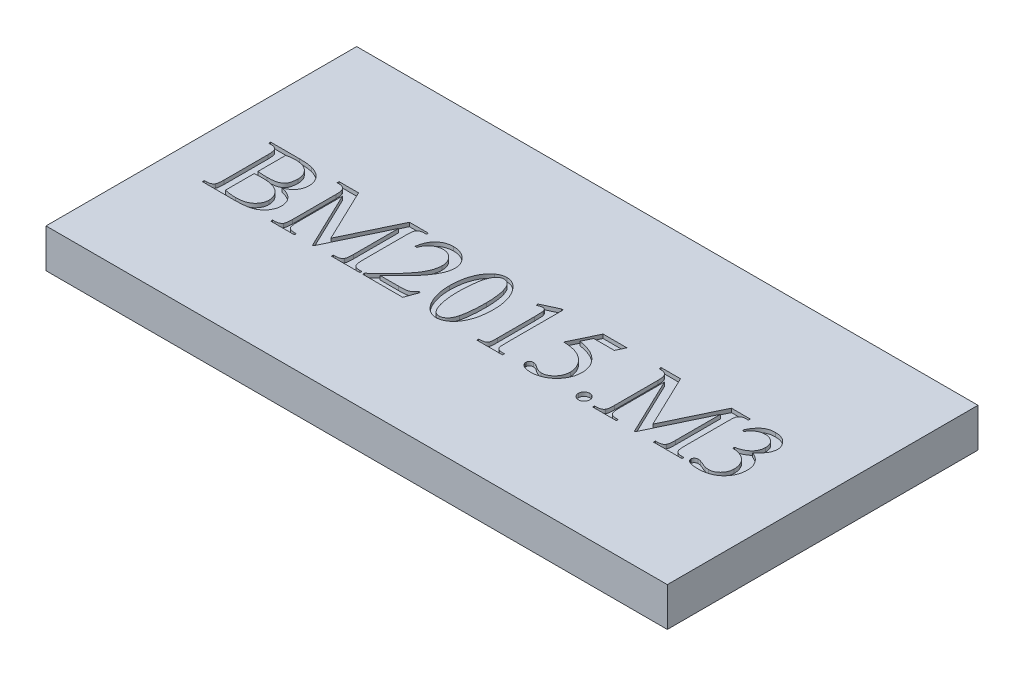
from build123d import *

# Parameters (mm, degrees)
SKETCH_1_W          = 160
SKETCH_1_H          = 80
EXTRUDE_1_DEPTH     = 10
CUT_EXTRUDE_1_DEPTH = 1


with BuildPart() as part:
    # Эскиз1 → Бобышка-Вытянуть1 (new body)
    with BuildSketch(Plane(origin=(0, 0, 0), x_dir=(1, 0, 0), z_dir=(0, 1, 0))):
        Rectangle(SKETCH_1_W, SKETCH_1_H)
    extrude(amount=EXTRUDE_1_DEPTH)

    # Эскиз2 → Вырез-Вытянуть1 (cut)
    # profile 1 of 9: a face of its own
    with BuildSketch(Plane(origin=(0, 10, 0), x_dir=(1, 0, 0), z_dir=(0, 1, 0))):
        with BuildLine():
            add(Edge.make_bspline(
                [(-58.083307054, -1.12936359), (-57.935151583, -1.162218616), (-57.647224583, -1.226069441), (-57.233701046, -1.344617735), (-56.85051146, -1.47956541), (-56.493404032, -1.623649358), (-56.164474978, -1.783325876), (-55.864999545, -1.959081857), (-55.595654967, -2.150476291), (-55.433679051, -2.291199058), (-55.354468452, -2.360016293)],
                knots=[0, 0, 0, 0, 1.202298385, 2.336560135, 3.406084711, 4.420247637, 5.386399354, 6.300522109, 7.168909389, 8, 8, 8, 8], degree=3))
            add(Edge.make_bspline(
                [(-55.354468452, -2.360016293), (-55.254240258, -2.45868109), (-55.056391441, -2.653443788), (-54.800647537, -2.975704736), (-54.585222065, -3.31438968), (-54.407168596, -3.668692158), (-54.270098938, -4.040713305), (-54.169543605, -4.428340837), (-54.111729232, -4.832307411), (-54.104533282, -5.106509479), (-54.100884332, -5.245552911)],
                knots=[0, 0, 0, 0, 1.040892545, 2.054704896, 3.038886078, 4.009403739, 4.985637774, 5.96968326, 6.970459233, 8, 8, 8, 8], degree=3))
            add(Edge.make_bspline(
                [(-54.100884332, -5.245552911), (-54.109773906, -5.459326742), (-54.127634896, -5.888842475), (-54.295807273, -6.522135238), (-54.552689425, -7.143512483), (-54.912842113, -7.737821359), (-55.35300588, -8.29336594), (-55.890156435, -8.76594946), (-56.496512251, -9.163913784), (-57.062965395, -9.427120756), (-57.567328024, -9.591580546), (-57.996528063, -9.700807422), (-58.471665181, -9.79862292), (-58.995936524, -9.865487586), (-59.565085802, -9.929753148), (-60.182391491, -9.968570826), (-60.846269083, -9.997197456), (-61.305134604, -9.999045516), (-61.542129093, -10)],
                knots=[0, 0, 0, 0, 1.028770293, 2.067011775, 3.138033473, 4.261901228, 5.406207792, 6.541562624, 7.694800496, 8.892876887, 9.539626609, 10.250184141, 11.027081459, 11.876550478, 12.796927842, 13.788050093, 14.85757392, 16, 16, 16, 16], degree=3))
            Line((-61.542129093, -10), (-69.75539822, -10))
            Line((-69.75539822, -10), (-69.75539822, -9.510796441))
            Line((-69.75539822, -9.510796441), (-69.117140452, -9.510796441))
            add(Edge.make_bspline(
                [(-69.117140452, -9.510796441), (-69.031623978, -9.508896469), (-68.866223486, -9.505221663), (-68.628601462, -9.468555371), (-68.407591735, -9.418383705), (-68.208553017, -9.33583787), (-68.025639816, -9.235762485), (-67.860349201, -9.114310171), (-67.716452197, -8.965560139), (-67.636649307, -8.85326698), (-67.596023136, -8.796100616)],
                knots=[0, 0, 0, 0, 1.166786496, 2.256723755, 3.277842578, 4.25348796, 5.187934752, 6.120436128, 7.043148905, 8, 8, 8, 8], degree=3))
            add(Edge.make_bspline(
                [(-67.596023136, -8.796100616), (-67.571713165, -8.752126879), (-67.519273623, -8.65727022), (-67.465120099, -8.488517952), (-67.415028953, -8.29096451), (-67.378860094, -8.059207847), (-67.348406901, -7.795301677), (-67.326671955, -7.498195236), (-67.310194933, -7.169426686), (-67.309659765, -6.939953985), (-67.309380425, -6.820176866)],
                knots=[0, 0, 0, 0, 0.597321695, 1.288494999, 2.101981578, 3.025155317, 4.079375286, 5.266669335, 6.573292293, 8, 8, 8, 8], degree=3))
            Line((-67.309380425, -6.820176866), (-67.309380425, 4.431504991))
            add(Edge.make_bspline(
                [(-67.309380425, 4.431504991), (-67.309187714, 4.564044157), (-67.308820582, 4.816542143), (-67.331060069, 5.175734867), (-67.353432169, 5.49775157), (-67.397357301, 5.780488463), (-67.445093055, 6.026200292), (-67.503113973, 6.234101896), (-67.579857841, 6.40226176), (-67.643258386, 6.494765474), (-67.672461192, 6.537373437)],
                knots=[0, 0, 0, 0, 1.467983741, 2.79662948, 3.986363477, 5.042318655, 5.964098798, 6.759038926, 7.428403245, 8, 8, 8, 8], degree=3))
            add(Edge.make_bspline(
                [(-67.672461192, 6.537373437), (-67.75871544, 6.62793383), (-67.93276243, 6.810669917), (-68.27906898, 6.993817977), (-68.679994602, 7.101831697), (-68.966045307, 7.115110536), (-69.117140452, 7.122124566)],
                knots=[0, 0, 0, 0, 0.927123666, 1.870784184, 2.875324672, 4, 4, 4, 4], degree=3))
            Line((-69.117140452, 7.122124566), (-69.75539822, 7.122124566))
            Line((-69.75539822, 7.122124566), (-69.75539822, 7.611328125))
            Line((-69.75539822, 7.611328125), (-62.321797265, 7.611328125))
            add(Edge.make_bspline(
                [(-62.321797265, 7.611328125), (-61.991696852, 7.608620798), (-61.366532154, 7.603493494), (-60.480230914, 7.540198231), (-59.694905134, 7.449140638), (-59.211425828, 7.343516417), (-58.985276116, 7.294110192)],
                knots=[0, 0, 0, 0, 1.179035714, 2.232931189, 3.173445281, 4, 4, 4, 4], degree=3))
            add(Edge.make_bspline(
                [(-58.985276116, 7.294110192), (-58.830475378, 7.252962713), (-58.528036356, 7.172571601), (-58.094236564, 7.017852333), (-57.687918639, 6.842263366), (-57.308550965, 6.64475572), (-56.960169398, 6.420895489), (-56.635313397, 6.180274305), (-56.341120668, 5.912497706), (-56.077791535, 5.621954778), (-55.845558733, 5.314460125), (-55.635433656, 4.998206342), (-55.46620313, 4.664377227), (-55.321125295, 4.323333768), (-55.216617894, 3.968594551), (-55.133743431, 3.605365528), (-55.088177792, 3.228770232), (-55.082276671, 2.974197134), (-55.07929145, 2.845415327)],
                knots=[0, 0, 0, 0, 1.197163213, 2.33893505, 3.43955965, 4.504702612, 5.532566955, 6.532694419, 7.523891994, 8.501634608, 9.459882266, 10.403051993, 11.336018195, 12.25408421, 13.170072591, 14.09679423, 15.037218469, 16, 16, 16, 16], degree=3))
            add(Edge.make_bspline(
                [(-55.07929145, 2.845415327), (-55.087105251, 2.626697856), (-55.102503874, 2.195672354), (-55.254775946, 1.570239949), (-55.494999798, 0.980157447), (-55.769984581, 0.520936195), (-56.040008985, 0.18304697), (-56.260992368, -0.061223322), (-56.510751786, -0.280656081), (-56.780704725, -0.486435746), (-57.075219861, -0.671124202), (-57.389016851, -0.845114708), (-57.727138198, -0.997833345), (-57.962993001, -1.084932594), (-58.083307054, -1.12936359)],
                knots=[0, 0, 0, 0, 1.471082931, 2.899056279, 4.307818116, 5.751614296, 6.484736272, 7.219614112, 7.967209451, 8.720692231, 9.503935749, 10.306636219, 11.136182697, 12, 12, 12, 12], degree=3))
        make_face()
        with BuildLine():
            add(Edge.make_bspline(
                [(-64.86336263, -0.514037238), (-64.692945887, -0.544093737), (-64.330720479, -0.607979641), (-63.74976447, -0.665695354), (-63.104427144, -0.699142348), (-62.653075855, -0.703077259), (-62.417344835, -0.705132378)],
                knots=[0, 0, 0, 0, 0.844887106, 1.795830451, 2.848809897, 4, 4, 4, 4], degree=3))
            add(Edge.make_bspline(
                [(-62.417344835, -0.705132378), (-62.264458487, -0.703354118), (-61.968755926, -0.699914726), (-61.540241642, -0.682406439), (-61.141479761, -0.646432822), (-60.77225986, -0.603915856), (-60.432400817, -0.539958425), (-60.120906283, -0.471510955), (-59.83948761, -0.381490273), (-59.509469981, -0.253532815), (-59.145320321, -0.055754639), (-58.782767834, 0.249409046), (-58.5028781, 0.615111097), (-58.309990283, 1.035402248), (-58.185415618, 1.49099766), (-58.082207176, 1.965085911), (-58.025496826, 2.460574051), (-58.018212998, 2.796874932), (-58.014512804, 2.967716217)],
                knots=[0, 0, 0, 0, 1.091830023, 2.111744693, 3.061402081, 3.95056914, 4.764258185, 5.530001833, 6.226288629, 6.871621508, 8.056545267, 9.166642, 10.231067328, 11.317616446, 12.446050905, 13.598649409, 14.780110772, 16, 16, 16, 16], degree=3))
            add(Edge.make_bspline(
                [(-58.014512804, 2.967716217), (-58.018532349, 3.100348912), (-58.026450031, 3.361608221), (-58.078788197, 3.746816082), (-58.17745199, 4.11571906), (-58.305925913, 4.471005959), (-58.472293973, 4.812706909), (-58.678876152, 5.1359246), (-58.923389495, 5.44449433), (-59.199645402, 5.737669378), (-59.513245855, 6.006493611), (-59.863872586, 6.240298016), (-60.246837904, 6.439488964), (-60.665050033, 6.600434926), (-61.115481955, 6.726083784), (-61.601863798, 6.812476281), (-62.120568156, 6.866431758), (-62.478357766, 6.873761667), (-62.661946615, 6.877522786)],
                knots=[0, 0, 0, 0, 0.932104058, 1.836054539, 2.724128921, 3.610577454, 4.48739039, 5.388899496, 6.300486582, 7.250348221, 8.215526472, 9.196272454, 10.205292906, 11.242666987, 12.339557976, 13.48617357, 14.710106481, 16, 16, 16, 16], degree=3))
            add(Edge.make_bspline(
                [(-62.661946615, 6.877522786), (-62.860795409, 6.873608591), (-63.249040527, 6.865966266), (-63.816627037, 6.813568002), (-64.353439342, 6.719038008), (-64.695808207, 6.625292952), (-64.86336263, 6.579414368)],
                knots=[0, 0, 0, 0, 1.070391011, 2.089899941, 3.065202048, 4, 4, 4, 4], degree=3))
            Line((-64.86336263, 6.579414368), (-64.86336263, -0.514037238))
        make_face(mode=Mode.SUBTRACT)
        with BuildLine():
            add(Edge.make_bspline(
                [(-64.86336263, -8.910757701), (-64.61299155, -8.966180517), (-64.114860083, -9.076448239), (-63.363817105, -9.184042878), (-62.617351025, -9.252129061), (-62.121930429, -9.261511361), (-61.874634637, -9.266194661)],
                knots=[0, 0, 0, 0, 1.019899824, 2.029164851, 3.016231376, 4, 4, 4, 4], degree=3))
            add(Edge.make_bspline(
                [(-61.874634637, -9.266194661), (-61.683369781, -9.264270033), (-61.312764466, -9.260540768), (-60.774376461, -9.2029356), (-60.270130022, -9.1230579), (-59.801690352, -9.002553889), (-59.365782736, -8.856219159), (-58.968358656, -8.667884751), (-58.604287484, -8.448091229), (-58.275754279, -8.197059756), (-57.988329946, -7.917211908), (-57.731150394, -7.625922238), (-57.51743584, -7.314627966), (-57.338767101, -6.989153368), (-57.205635762, -6.643858337), (-57.105081161, -6.286025716), (-57.046688177, -5.909925052), (-57.039679488, -5.654695807), (-57.036105686, -5.524551815)],
                knots=[0, 0, 0, 0, 1.335369974, 2.58748639, 3.778398001, 4.898614871, 5.962444548, 6.985554789, 7.963871145, 8.928614683, 9.866425566, 10.762210136, 11.638554271, 12.498661649, 13.349744001, 14.217688406, 15.091181162, 16, 16, 16, 16], degree=3))
            add(Edge.make_bspline(
                [(-57.036105686, -5.524551815), (-57.044261503, -5.352107441), (-57.060606005, -5.006523727), (-57.16883186, -4.492320686), (-57.362031352, -3.993866839), (-57.61631526, -3.505399873), (-57.950977807, -3.043834451), (-58.380301928, -2.636913587), (-58.88735204, -2.276838993), (-59.479994141, -1.978732112), (-60.147210303, -1.733123454), (-60.891331413, -1.559195298), (-61.708700466, -1.456962118), (-62.278174481, -1.445100422), (-62.57404285, -1.438937717)],
                knots=[0, 0, 0, 0, 0.80426076, 1.611762754, 2.437163379, 3.29025987, 4.174362993, 5.081949637, 6.03643416, 7.064744133, 8.166225842, 9.344998398, 10.620602567, 12, 12, 12, 12], degree=3))
            add(Edge.make_bspline(
                [(-62.57404285, -1.438937717), (-62.702722848, -1.438160339), (-62.951191532, -1.436659297), (-63.309109527, -1.447026636), (-63.637907963, -1.452656868), (-64.017637519, -1.468393209), (-64.424649074, -1.488178676), (-64.72856052, -1.536142157), (-64.86336263, -1.557416704)],
                knots=[0, 0, 0, 0, 1.009225997, 1.948718216, 2.808291512, 3.588270035, 4.930259813, 6, 6, 6, 6], degree=3))
            Line((-64.86336263, -1.557416704), (-64.86336263, -8.910757701))
        make_face(mode=Mode.SUBTRACT)
    # profile 2 of 9: a face of its own
    with BuildSketch(Plane(origin=(0, 10, 0), x_dir=(1, 0, 0), z_dir=(0, 1, 0))):
        with BuildLine():
            Line((-41.381591797, -10), (-48.475043403, 4.817517175))
            Line((-48.475043403, 4.817517175), (-48.475043403, -6.820176866))
            add(Edge.make_bspline(
                [(-48.475043403, -6.820176866), (-48.475224162, -6.955261145), (-48.475567139, -7.211573693), (-48.453681123, -7.57589808), (-48.429942711, -7.901426525), (-48.390519157, -8.186701203), (-48.348683291, -8.434798906), (-48.286350012, -8.639672396), (-48.221565226, -8.809918629), (-48.159424357, -8.900159771), (-48.13107215, -8.941332923)],
                knots=[0, 0, 0, 0, 1.48973486, 2.826663046, 4.025252461, 5.088590954, 6.003687083, 6.795186099, 7.45029523, 8, 8, 8, 8], degree=3))
            add(Edge.make_bspline(
                [(-48.13107215, -8.941332923), (-48.044633234, -9.029283516), (-47.868608314, -9.208386828), (-47.515174715, -9.388466568), (-47.099129811, -9.495079221), (-46.799236034, -9.505357239), (-46.640530056, -9.510796441)],
                knots=[0, 0, 0, 0, 0.893460505, 1.819450328, 2.846037184, 4, 4, 4, 4], degree=3))
            Line((-46.640530056, -9.510796441), (-46.029025608, -9.510796441))
            Line((-46.029025608, -9.510796441), (-46.029025608, -10))
            Line((-46.029025608, -10), (-52.144070095, -10))
            Line((-52.144070095, -10), (-52.144070095, -9.510796441))
            Line((-52.144070095, -9.510796441), (-51.532565647, -9.510796441))
            add(Edge.make_bspline(
                [(-51.532565647, -9.510796441), (-51.444512528, -9.508874283), (-51.274061196, -9.505153411), (-51.028740976, -9.468702177), (-50.802097877, -9.418104563), (-50.595868322, -9.33937337), (-50.40809511, -9.241570039), (-50.241366342, -9.118046394), (-50.09860767, -8.969822735), (-50.017862565, -8.859503545), (-49.977051205, -8.803744422)],
                knots=[0, 0, 0, 0, 1.182386838, 2.288838982, 3.326958154, 4.296765023, 5.246416275, 6.164047556, 7.072046332, 8, 8, 8, 8], degree=3))
            add(Edge.make_bspline(
                [(-49.977051205, -8.803744422), (-49.954270382, -8.762227325), (-49.904120352, -8.670830994), (-49.848621244, -8.508339338), (-49.805341866, -8.310440578), (-49.762452009, -8.080093594), (-49.732410828, -7.813218108), (-49.716775585, -7.513311385), (-49.698335248, -7.178367859), (-49.698149942, -6.943784475), (-49.6980523, -6.820176866)],
                knots=[0, 0, 0, 0, 0.561580455, 1.236271222, 2.028879402, 2.966584022, 4.017422664, 5.2149421, 6.532486222, 8, 8, 8, 8], degree=3))
            Line((-49.6980523, -6.820176866), (-49.6980523, 4.431504991))
            add(Edge.make_bspline(
                [(-49.6980523, 4.431504991), (-49.699976551, 4.621522776), (-49.703548912, 4.9742897), (-49.753858364, 5.459502225), (-49.825140608, 5.863803464), (-49.914062291, 6.093672525), (-49.954119788, 6.197224087)],
                knots=[0, 0, 0, 0, 1.269100049, 2.356076937, 3.259444487, 4, 4, 4, 4], degree=3))
            add(Edge.make_bspline(
                [(-49.954119788, 6.197224087), (-49.987685313, 6.26097027), (-50.056737383, 6.392110954), (-50.203440631, 6.567260268), (-50.390281442, 6.72258539), (-50.614620977, 6.867275248), (-50.898281446, 6.988835152), (-51.251189315, 7.067655514), (-51.673881339, 7.116087696), (-51.979566908, 7.120012469), (-52.144070095, 7.122124566)],
                knots=[0, 0, 0, 0, 0.685675889, 1.410594349, 2.160436148, 2.996293973, 3.94870651, 5.086176952, 6.431940446, 8, 8, 8, 8], degree=3))
            Line((-52.144070095, 7.122124566), (-52.144070095, 7.611328125))
            Line((-52.144070095, 7.611328125), (-47.129733615, 7.611328125))
            Line((-47.129733615, 7.611328125), (-40.578992208, -6.071083917))
            Line((-40.578992208, -6.071083917), (-34.0282508, 7.611328125))
            Line((-34.0282508, 7.611328125), (-29.151502821, 7.611328125))
            Line((-29.151502821, 7.611328125), (-29.151502821, 7.122124566))
            Line((-29.151502821, 7.122124566), (-29.751541562, 7.122124566))
            add(Edge.make_bspline(
                [(-29.751541562, 7.122124566), (-29.840881134, 7.120293258), (-30.012630645, 7.116772686), (-30.260326634, 7.079476113), (-30.488561493, 7.030130603), (-30.69581301, 6.950585862), (-30.88386158, 6.853113694), (-31.050378351, 6.728114751), (-31.197076831, 6.582509492), (-31.277924441, 6.471044301), (-31.318521712, 6.415072547)],
                knots=[0, 0, 0, 0, 1.192663738, 2.292818382, 3.341598875, 4.305885976, 5.250132179, 6.162540657, 7.077327887, 8, 8, 8, 8], degree=3))
            add(Edge.make_bspline(
                [(-31.318521712, 6.415072547), (-31.341302535, 6.37355545), (-31.391452565, 6.282159119), (-31.446951673, 6.119667463), (-31.49023105, 5.921768703), (-31.533120908, 5.691421719), (-31.563162089, 5.424546233), (-31.578797332, 5.12463951), (-31.597237669, 4.789695984), (-31.597422974, 4.5551126), (-31.597520616, 4.431504991)],
                knots=[0, 0, 0, 0, 0.561580455, 1.236271222, 2.028879402, 2.966584022, 4.017422664, 5.2149421, 6.532486222, 8, 8, 8, 8], degree=3))
            Line((-31.597520616, 4.431504991), (-31.597520616, -6.820176866))
            add(Edge.make_bspline(
                [(-31.597520616, -6.820176866), (-31.597683342, -6.955257386), (-31.597992101, -7.211562802), (-31.576334729, -7.575934845), (-31.551860101, -7.901309842), (-31.514693869, -8.187303867), (-31.465886306, -8.4341995), (-31.406224026, -8.640621855), (-31.336310192, -8.810298427), (-31.27166525, -8.900195792), (-31.242083655, -8.941332923)],
                knots=[0, 0, 0, 0, 1.486776415, 2.821049613, 4.017258766, 5.078485589, 5.994452933, 6.784380121, 7.443731031, 8, 8, 8, 8], degree=3))
            add(Edge.make_bspline(
                [(-31.242083655, -8.941332923), (-31.155718913, -9.029440256), (-30.979052652, -9.209671132), (-30.624150738, -9.386686811), (-30.209129193, -9.495788696), (-29.910324729, -9.505588745), (-29.751541562, -9.510796441)],
                knots=[0, 0, 0, 0, 0.893634595, 1.828003868, 2.845812335, 4, 4, 4, 4], degree=3))
            Line((-29.751541562, -9.510796441), (-29.151502821, -9.510796441))
            Line((-29.151502821, -9.510796441), (-29.151502821, -10))
            Line((-29.151502821, -10), (-36.489556207, -10))
            Line((-36.489556207, -10), (-36.489556207, -9.510796441))
            Line((-36.489556207, -9.510796441), (-35.878051758, -9.510796441))
            add(Edge.make_bspline(
                [(-35.878051758, -9.510796441), (-35.788729236, -9.508908991), (-35.617012503, -9.505280493), (-35.370318142, -9.468915019), (-35.142892304, -9.417114805), (-34.935344757, -9.341362154), (-34.749116434, -9.240317632), (-34.583127351, -9.11807279), (-34.440165821, -8.970838698), (-34.361884496, -8.859638089), (-34.322537316, -8.803744422)],
                knots=[0, 0, 0, 0, 1.198333024, 2.303717216, 3.340834392, 4.325725627, 5.259386468, 6.176132048, 7.08325442, 8, 8, 8, 8], degree=3))
            add(Edge.make_bspline(
                [(-34.322537316, -8.803744422), (-34.299756493, -8.762227325), (-34.249606463, -8.670830994), (-34.194107355, -8.508339338), (-34.150827978, -8.310440578), (-34.10793812, -8.080093594), (-34.077896939, -7.813218108), (-34.062261696, -7.513311385), (-34.043821359, -7.178367859), (-34.043636054, -6.943784475), (-34.043538411, -6.820176866)],
                knots=[0, 0, 0, 0, 0.561580455, 1.236271222, 2.028879402, 2.966584022, 4.017422664, 5.2149421, 6.532486222, 8, 8, 8, 8], degree=3))
            Line((-34.043538411, -6.820176866), (-34.043538411, 4.817517175))
            Line((-34.043538411, 4.817517175), (-41.136990017, -10))
            Line((-41.136990017, -10), (-41.381591797, -10))
        make_face()
    # profile 3 of 9: a face of its own
    with BuildSketch(Plane(origin=(0, 10, 0), x_dir=(1, 0, 0), z_dir=(0, 1, 0))):
        with BuildLine():
            Line((-16.921413845, -6.625259823), (-18.14060084, -10))
            Line((-18.14060084, -10), (-28.417697483, -10))
            Line((-28.417697483, -10), (-28.417697483, -9.522262149))
            add(Edge.make_bspline(
                [(-28.417697483, -9.522262149), (-28.049962701, -9.184284741), (-27.337208561, -8.529207198), (-26.317028371, -7.564400857), (-25.382387985, -6.646322311), (-24.533063777, -5.775332429), (-23.768274698, -4.952023491), (-23.089825636, -4.173799915), (-22.492136687, -3.447487308), (-21.977980964, -2.7593731), (-21.531297964, -2.10503188), (-21.152910225, -1.4657044), (-20.830235974, -0.8421502), (-20.56276819, -0.233347909), (-20.359861129, 0.364295092), (-20.213485834, 0.946947654), (-20.120603261, 1.514976731), (-20.107610584, 1.889612186), (-20.101236979, 2.073390961)],
                knots=[0, 0, 0, 0, 1.640196139, 3.179075376, 4.61094688, 5.942305235, 7.173872596, 8.30065911, 9.332401675, 10.262017718, 11.120692698, 11.932909408, 12.700076558, 13.425218913, 14.114511764, 14.770003029, 15.396620544, 16, 16, 16, 16], degree=3))
            add(Edge.make_bspline(
                [(-20.101236979, 2.073390961), (-20.10370474, 2.209869651), (-20.108542321, 2.477410385), (-20.160291182, 2.868665388), (-20.240869872, 3.241830458), (-20.349058871, 3.598074853), (-20.498284173, 3.932849655), (-20.671406647, 4.252011432), (-20.886201144, 4.547209051), (-21.124060691, 4.824611076), (-21.385867657, 5.074798563), (-21.66300152, 5.293732585), (-21.950447126, 5.483527854), (-22.252568271, 5.63743977), (-22.569317732, 5.751446209), (-22.8967657, 5.835682054), (-23.237044746, 5.892573979), (-23.469376136, 5.896919264), (-23.586812337, 5.899115668)],
                knots=[0, 0, 0, 0, 1.134419306, 2.223815103, 3.275304008, 4.307399035, 5.313221346, 6.318597171, 7.32112197, 8.342723066, 9.354331769, 10.327252885, 11.276405737, 12.214555788, 13.139633085, 14.069852934, 15.024371439, 16, 16, 16, 16], degree=3))
            add(Edge.make_bspline(
                [(-23.586812337, 5.899115668), (-23.799140972, 5.891013996), (-24.21725078, 5.875060479), (-24.824863941, 5.726892013), (-25.399228557, 5.491312143), (-25.934481849, 5.162069128), (-26.419679188, 4.742389989), (-26.841795751, 4.233577877), (-27.192538134, 3.635052479), (-27.360368563, 3.192275286), (-27.44693417, 2.963894314)],
                knots=[0, 0, 0, 0, 0.978774112, 1.927366301, 2.868767021, 3.835023234, 4.81480387, 5.817007219, 6.874029602, 8, 8, 8, 8], degree=3))
            Line((-27.44693417, 2.963894314), (-27.928493924, 2.963894314))
            add(Edge.make_bspline(
                [(-27.928493924, 2.963894314), (-27.899622971, 3.155558226), (-27.843215303, 3.53002853), (-27.710501317, 4.069536579), (-27.55258225, 4.576946559), (-27.355519174, 5.046960457), (-27.134390838, 5.487427775), (-26.878727441, 5.892127147), (-26.590404285, 6.263183943), (-26.267732069, 6.594806512), (-25.922030566, 6.893128235), (-25.552086656, 7.149704246), (-25.163924952, 7.372048836), (-24.75043071, 7.544532532), (-24.318708276, 7.684835618), (-23.866697178, 7.782294838), (-23.393748217, 7.846687545), (-23.07107543, 7.85280833), (-22.906513638, 7.855929905)],
                knots=[0, 0, 0, 0, 1.200501633, 2.345523519, 3.439068721, 4.490246694, 5.499995932, 6.48995494, 7.451685612, 8.406391985, 9.352574024, 10.27676432, 11.192316343, 12.119031984, 13.047762957, 14.001652993, 14.980851257, 16, 16, 16, 16], degree=3))
            add(Edge.make_bspline(
                [(-22.906513638, 7.855929905), (-22.73182676, 7.850989345), (-22.389023402, 7.841294053), (-21.884418405, 7.780738851), (-21.402400767, 7.672808773), (-20.940193943, 7.525111162), (-20.504405459, 7.327144342), (-20.087066374, 7.094731764), (-19.696360766, 6.811978979), (-19.330096058, 6.49413165), (-18.993587465, 6.149570204), (-18.704831758, 5.78041709), (-18.45035961, 5.402142391), (-18.254061616, 5.00159255), (-18.094499051, 4.58903364), (-17.97912917, 4.161582388), (-17.913606904, 3.716294331), (-17.904466544, 3.415089713), (-17.899820964, 3.262002733)],
                knots=[0, 0, 0, 0, 1.109419983, 2.177111989, 3.221343547, 4.242152537, 5.252521162, 6.255999647, 7.270763728, 8.308866099, 9.333003754, 10.32358272, 11.281716678, 12.222409134, 13.149434629, 14.0874794, 15.027963099, 16, 16, 16, 16], degree=3))
            add(Edge.make_bspline(
                [(-17.899820964, 3.262002733), (-17.906885075, 3.039774486), (-17.921112713, 2.592190497), (-18.047207343, 1.924911451), (-18.240045278, 1.255752628), (-18.42972743, 0.825529217), (-18.526613024, 0.605780284)],
                knots=[0, 0, 0, 0, 0.968670703, 1.950973842, 2.953401185, 4, 4, 4, 4], degree=3))
            add(Edge.make_bspline(
                [(-18.526613024, 0.605780284), (-18.610913654, 0.428757641), (-18.78282303, 0.067765657), (-19.09080369, -0.462221098), (-19.425703527, -1.004892836), (-19.797131775, -1.55723393), (-20.209623466, -2.114039465), (-20.664047598, -2.675068601), (-21.147386427, -3.250337108), (-21.49228952, -3.627566572), (-21.668217129, -3.819983164)],
                knots=[0, 0, 0, 0, 0.863272392, 1.760421205, 2.69783519, 3.672094839, 4.691137575, 5.748887515, 6.851756197, 8, 8, 8, 8], degree=3))
            add(Edge.make_bspline(
                [(-21.668217129, -3.819983164), (-21.927939485, -4.087678129), (-22.42227903, -4.597192247), (-23.128719542, -5.320150772), (-23.76605255, -5.961921808), (-24.325096361, -6.532859337), (-24.817766094, -7.021209511), (-25.239043973, -7.430554108), (-25.585947855, -7.764045295), (-25.79563336, -7.958083803), (-25.887597826, -8.043185764)],
                knots=[0, 0, 0, 0, 1.49931882, 2.853711152, 4.0632012, 5.135089847, 6.065735724, 6.851603135, 7.496332836, 8, 8, 8, 8], degree=3))
            Line((-25.887597826, -8.043185764), (-21.236342112, -8.043185764))
            add(Edge.make_bspline(
                [(-21.236342112, -8.043185764), (-21.017197625, -8.041745886), (-20.614485178, -8.039099883), (-20.062671956, -8.020081787), (-19.617193774, -7.993814419), (-19.26163778, -7.948212422), (-18.965908948, -7.880166739), (-18.699841131, -7.788563046), (-18.446139388, -7.673131375), (-18.20829291, -7.525869003), (-17.981817191, -7.351223065), (-17.774103175, -7.139737641), (-17.576851451, -6.900284294), (-17.466993092, -6.718530088), (-17.410617405, -6.625259823)],
                knots=[0, 0, 0, 0, 1.821637222, 3.347544769, 4.589491042, 5.530053278, 6.323823777, 7.107498442, 7.865641253, 8.635746017, 9.428031577, 10.236778878, 11.095173072, 12, 12, 12, 12], degree=3))
            Line((-17.410617405, -6.625259823), (-16.921413845, -6.625259823))
        make_face()
    # profile 4 of 9: a face of its own
    with BuildSketch(Plane(origin=(0, 10, 0), x_dir=(1, 0, 0), z_dir=(0, 1, 0))):
        with BuildLine():
            add(Edge.make_bspline(
                [(-14.71999783, -1.324280633), (-14.716463312, -1.079638546), (-14.709518908, -0.598980708), (-14.67262676, 0.108899861), (-14.60431309, 0.791361978), (-14.503987398, 1.446363769), (-14.382160885, 2.07666124), (-14.234859207, 2.681014159), (-14.054194106, 3.258475859), (-13.849054524, 3.808627234), (-13.617551902, 4.327053844), (-13.377520059, 4.818453922), (-13.105963534, 5.269500413), (-12.825737006, 5.69007838), (-12.526766354, 6.07700528), (-12.20291243, 6.422727906), (-11.869948706, 6.744886236), (-11.626237937, 6.928284061), (-11.505777571, 7.01893319)],
                knots=[0, 0, 0, 0, 1.267948223, 2.491187271, 3.672419621, 4.820944812, 5.924168987, 6.998668076, 8.042818115, 9.058224754, 10.039662809, 10.984530588, 11.890392543, 12.765710998, 13.603053422, 14.420720048, 15.219399938, 16, 16, 16, 16], degree=3))
            add(Edge.make_bspline(
                [(-11.505777571, 7.01893319), (-11.31960454, 7.147533712), (-10.959488199, 7.396286979), (-10.372000283, 7.657086086), (-9.77728641, 7.823851146), (-9.374209431, 7.845298919), (-9.17441686, 7.855929905)],
                knots=[0, 0, 0, 0, 1.076116545, 2.081542914, 3.049081206, 4, 4, 4, 4], degree=3))
            add(Edge.make_bspline(
                [(-9.17441686, 7.855929905), (-9.012134387, 7.850469588), (-8.689784333, 7.839623479), (-8.213989406, 7.739147568), (-7.751420934, 7.577555408), (-7.303044685, 7.349378672), (-6.867223318, 7.059280607), (-6.446228827, 6.703849965), (-6.036030137, 6.287138449), (-5.786625137, 5.972925065), (-5.658266279, 5.811211904)],
                knots=[0, 0, 0, 0, 0.921550053, 1.830522441, 2.751246923, 3.70019056, 4.682375705, 5.720881843, 6.827028318, 8, 8, 8, 8], degree=3))
            add(Edge.make_bspline(
                [(-5.658266279, 5.811211904), (-5.502362148, 5.593641132), (-5.18758535, 5.154356873), (-4.788844756, 4.433668801), (-4.459729993, 3.654101274), (-4.18117436, 2.821983027), (-3.975341736, 1.931822646), (-3.821749089, 0.98724994), (-3.729591723, -0.014085673), (-3.718564491, -0.701116264), (-3.712917752, -1.052925534)],
                knots=[0, 0, 0, 0, 0.883963831, 1.784759013, 2.714530965, 3.677036329, 4.680787027, 5.730006124, 6.837599228, 8, 8, 8, 8], degree=3))
            add(Edge.make_bspline(
                [(-3.712917752, -1.052925534), (-3.71423776, -1.301432704), (-3.716825662, -1.78863558), (-3.763128327, -2.504805296), (-3.823376957, -3.192815174), (-3.922513952, -3.851280557), (-4.037093284, -4.483908971), (-4.188695315, -5.08613273), (-4.357208489, -5.662270482), (-4.562268169, -6.203847093), (-4.78299341, -6.713317505), (-5.014882356, -7.19141007), (-5.268762012, -7.629584918), (-5.530460645, -8.036685463), (-5.809873939, -8.405102838), (-6.105757391, -8.735480764), (-6.415644104, -9.031654013), (-6.74006793, -9.289439494), (-7.067559408, -9.514747915), (-7.39561443, -9.706688045), (-7.718954396, -9.872260638), (-8.041753384, -10.005121572), (-8.358226209, -10.115879236), (-8.67407939, -10.185959839), (-8.985553079, -10.23605179), (-9.193329928, -10.241760953), (-9.29671775, -10.24460178)],
                knots=[0, 0, 0, 0, 1.510050896, 2.960482548, 4.360412811, 5.706191847, 7.006128856, 8.266230485, 9.478809624, 10.652394328, 11.782968825, 12.852979618, 13.879641343, 14.858961868, 15.792780312, 16.68657793, 17.551917979, 18.394760493, 19.202293251, 19.965865945, 20.70343888, 21.408045917, 22.086293389, 22.738035093, 23.372058038, 24, 24, 24, 24], degree=3))
            add(Edge.make_bspline(
                [(-9.29671775, -10.24460178), (-9.496306248, -10.236105273), (-9.891434928, -10.219284598), (-10.469397398, -10.0742171), (-11.022865454, -9.844109964), (-11.545281894, -9.512280361), (-12.042523337, -9.093471148), (-12.514241373, -8.583796591), (-12.95767734, -7.980958563), (-13.217150431, -7.533739377), (-13.351756626, -7.30173662)],
                knots=[0, 0, 0, 0, 0.907345466, 1.796286953, 2.695609492, 3.62566933, 4.601329434, 5.647644493, 6.779674527, 8, 8, 8, 8], degree=3))
            add(Edge.make_bspline(
                [(-13.351756626, -7.30173662), (-13.462040604, -7.091828026), (-13.684726231, -6.667980178), (-13.961211559, -5.997423386), (-14.195380691, -5.294808941), (-14.38350185, -4.560985583), (-14.539434757, -3.797580759), (-14.644672986, -3.002015534), (-14.705447758, -2.17370069), (-14.715086062, -1.611025217), (-14.71999783, -1.324280633)],
                knots=[0, 0, 0, 0, 0.917887123, 1.853399498, 2.805111979, 3.783983157, 4.785434396, 5.820907986, 6.889514713, 8, 8, 8, 8], degree=3))
        make_face()
        with BuildLine():
            add(Edge.make_bspline(
                [(-12.273980035, -1.630032857), (-12.270427448, -1.926895958), (-12.263487061, -2.506852262), (-12.227482365, -3.354829188), (-12.15762883, -4.16042021), (-12.063467509, -4.924335618), (-11.941459916, -5.647492662), (-11.794087266, -6.329409246), (-11.615164062, -6.968446087), (-11.472215616, -7.375041348), (-11.402586195, -7.573091719)],
                knots=[0, 0, 0, 0, 1.180112402, 2.305485676, 3.372849049, 4.393553838, 5.364293091, 6.287088038, 7.165649773, 8, 8, 8, 8], degree=3))
            add(Edge.make_bspline(
                [(-11.402586195, -7.573091719), (-11.342129321, -7.726170833), (-11.226760413, -8.018289315), (-11.010936193, -8.413324186), (-10.779136525, -8.751823689), (-10.51972709, -9.027048437), (-10.240078764, -9.24749024), (-9.931571336, -9.396351967), (-9.604627151, -9.494608491), (-9.377696974, -9.505340201), (-9.262320624, -9.510796441)],
                knots=[0, 0, 0, 0, 1.27796888, 2.438728037, 3.490730404, 4.457262314, 5.368188585, 6.240469892, 7.105415757, 8, 8, 8, 8], degree=3))
            add(Edge.make_bspline(
                [(-9.262320624, -9.510796441), (-9.146753759, -9.503169853), (-8.907288098, -9.487366829), (-8.550213518, -9.359330316), (-8.193443473, -9.15359115), (-7.895187724, -8.932403571), (-7.66776357, -8.707388931), (-7.496172048, -8.513156939), (-7.345818302, -8.283790008), (-7.200685156, -8.032875856), (-7.06541163, -7.754883264), (-6.945653563, -7.45000118), (-6.832627558, -7.118892102), (-6.771518279, -6.886859128), (-6.739864773, -6.766670227)],
                knots=[0, 0, 0, 0, 1.037825602, 2.150474477, 3.371635047, 4.73778764, 5.475301301, 6.247273825, 7.064217381, 7.93705097, 8.854564737, 9.842063216, 10.882227619, 12, 12, 12, 12], degree=3))
            add(Edge.make_bspline(
                [(-6.739864773, -6.766670227), (-6.691984509, -6.570915662), (-6.592086057, -6.162488968), (-6.477333168, -5.516384293), (-6.377190064, -4.814083047), (-6.299684601, -4.053984101), (-6.233777563, -3.236011408), (-6.189418723, -2.361700762), (-6.162067534, -1.430199615), (-6.160001362, -0.790508791), (-6.158935547, -0.460530599)],
                knots=[0, 0, 0, 0, 0.761713504, 1.589256053, 2.479498212, 3.443272477, 4.477217009, 5.58167292, 6.752529866, 8, 8, 8, 8], degree=3))
            add(Edge.make_bspline(
                [(-6.158935547, -0.460530599), (-6.159629382, -0.214612933), (-6.160992469, 0.268509484), (-6.194505273, 0.97695574), (-6.238412856, 1.653864493), (-6.302212834, 2.299253145), (-6.391351118, 2.911944444), (-6.493431397, 3.494930178), (-6.613993289, 4.046400029), (-6.713954078, 4.400095359), (-6.76279619, 4.572915395)],
                knots=[0, 0, 0, 0, 1.160165125, 2.279225349, 3.345596166, 4.360583534, 5.338162882, 6.266121345, 7.152804842, 8, 8, 8, 8], degree=3))
            add(Edge.make_bspline(
                [(-6.76279619, 4.572915395), (-6.801194822, 4.693040211), (-6.875691025, 4.926091294), (-7.00203939, 5.259009709), (-7.135757725, 5.565192264), (-7.275657476, 5.846504952), (-7.430158808, 6.096977413), (-7.584314416, 6.325880344), (-7.754781803, 6.522216837), (-7.876601141, 6.637665072), (-7.936120351, 6.694071452)],
                knots=[0, 0, 0, 0, 1.233545328, 2.393169741, 3.481419258, 4.501374537, 5.463177041, 6.358578008, 7.198024365, 8, 8, 8, 8], degree=3))
            add(Edge.make_bspline(
                [(-7.936120351, 6.694071452), (-8.024343064, 6.760152644), (-8.199996597, 6.891721879), (-8.506354838, 7.025200606), (-8.837527169, 7.107654336), (-9.068174051, 7.117235107), (-9.185882568, 7.122124566)],
                knots=[0, 0, 0, 0, 0.978770933, 1.948756365, 2.953166656, 4, 4, 4, 4], degree=3))
            add(Edge.make_bspline(
                [(-9.185882568, 7.122124566), (-9.326141088, 7.112696826), (-9.607122944, 7.093810103), (-10.010568301, 6.93379536), (-10.387312521, 6.677668922), (-10.599300107, 6.447994887), (-10.710821788, 6.327168783)],
                knots=[0, 0, 0, 0, 0.945219573, 1.893571615, 2.891857598, 4, 4, 4, 4], degree=3))
            add(Edge.make_bspline(
                [(-10.710821788, 6.327168783), (-10.785441112, 6.231751638), (-10.938327755, 6.036252589), (-11.136380874, 5.705511462), (-11.320608916, 5.339968741), (-11.478702142, 4.931451834), (-11.623386436, 4.487327388), (-11.755362842, 4.004767909), (-11.858409166, 3.481613577), (-11.979365136, 2.738224876), (-12.098140853, 1.786537842), (-12.193307188, 0.641310564), (-12.26529688, -0.496570254), (-12.271090348, -1.25282525), (-12.273980035, -1.630032857)],
                knots=[0, 0, 0, 0, 0.529149883, 1.084168889, 1.682003891, 2.317081463, 2.996986461, 3.723908646, 4.502772949, 5.326906926, 7.016784336, 8.694047759, 10.351045161, 12, 12, 12, 12], degree=3))
        make_face(mode=Mode.SUBTRACT)
    # profile 5 of 9: a face of its own
    with BuildSketch(Plane(origin=(0, 10, 0), x_dir=(1, 0, 0), z_dir=(0, 1, 0))):
        with BuildLine():
            Line((0.68991428, 5.899115668), (4.897829268, 7.855929905))
            Line((4.897829268, 7.855929905), (5.33734809, 7.855929905))
            Line((5.33734809, 7.855929905), (5.33734809, -6.820176866))
            add(Edge.make_bspline(
                [(5.33734809, -6.820176866), (5.338865316, -6.94119563), (5.341740078, -7.170495834), (5.342102563, -7.496806078), (5.356987855, -7.785798922), (5.364248378, -8.039794341), (5.386740702, -8.257206428), (5.401639981, -8.441650521), (5.429787182, -8.589065411), (5.462450074, -8.738106942), (5.529761526, -8.890489327), (5.643939018, -9.047332516), (5.791464278, -9.180936335), (5.979239189, -9.301947197), (6.239477109, -9.386931689), (6.584318375, -9.452873892), (7.028274202, -9.495313531), (7.357773249, -9.505307076), (7.538764106, -9.510796441)],
                knots=[0, 0, 0, 0, 1.356933168, 2.571048021, 3.657379777, 4.601012336, 5.418253307, 6.107533085, 6.673460353, 7.099554724, 7.815972102, 8.521630774, 9.259509655, 10.036179522, 11.007509208, 12.304408113, 13.970044684, 16, 16, 16, 16], degree=3))
            Line((7.538764106, -9.510796441), (7.538764106, -10))
            Line((7.538764106, -10), (0.934516059, -10))
            Line((0.934516059, -10), (0.934516059, -9.510796441))
            add(Edge.make_bspline(
                [(0.934516059, -9.510796441), (1.119358656, -9.505547272), (1.454004337, -9.496043987), (1.901259925, -9.451719967), (2.241652704, -9.392437482), (2.491921338, -9.309344095), (2.664750121, -9.191038199), (2.80594145, -9.070495828), (2.913414102, -8.927970171), (2.990251767, -8.795243027), (3.035104864, -8.659344623), (3.057753732, -8.514845002), (3.087031097, -8.331957612), (3.102810184, -8.107006082), (3.118418554, -7.842062283), (3.13053365, -7.537520867), (3.131738522, -7.19216767), (3.134481571, -6.948844414), (3.135932075, -6.820176866)],
                knots=[0, 0, 0, 0, 2.071302469, 3.74996044, 5.029173581, 5.941282905, 6.673651071, 7.361112001, 8.012044112, 8.663601818, 9.069808009, 9.607263055, 10.29959599, 11.144699654, 12.131164582, 13.273777592, 14.558393644, 16, 16, 16, 16], degree=3))
            Line((3.135932075, -6.820176866), (3.135932075, 2.719292535))
            add(Edge.make_bspline(
                [(3.135932075, 2.719292535), (3.13678555, 2.861987852), (3.138416447, 3.134662813), (3.127379242, 3.524408011), (3.123968946, 3.87500229), (3.105095677, 4.18431461), (3.094098672, 4.453703488), (3.0679679, 4.681236189), (3.049663669, 4.87106125), (3.024752406, 4.982011728), (3.013631185, 5.031543732)],
                knots=[0, 0, 0, 0, 1.476765178, 2.821934835, 4.035278551, 5.104597693, 6.029081604, 6.824151588, 7.47506195, 8, 8, 8, 8], degree=3))
            add(Edge.make_bspline(
                [(3.013631185, 5.031543732), (2.997414931, 5.093214322), (2.966676299, 5.210113672), (2.897186859, 5.370584922), (2.808567208, 5.507095778), (2.6680286, 5.65268389), (2.446409033, 5.784375661), (2.247422734, 5.80215508), (2.146059248, 5.811211904)],
                knots=[0, 0, 0, 0, 0.903062441, 1.711795068, 2.468214314, 3.196286531, 4.571790261, 6, 6, 6, 6], degree=3))
            add(Edge.make_bspline(
                [(2.146059248, 5.811211904), (2.062932455, 5.804423211), (1.877726938, 5.789298084), (1.579671072, 5.711948477), (1.23847836, 5.582491261), (1.001238306, 5.470354154), (0.873365614, 5.409912109)],
                knots=[0, 0, 0, 0, 0.743837888, 1.657262055, 2.737261251, 4, 4, 4, 4], degree=3))
            Line((0.873365614, 5.409912109), (0.68991428, 5.899115668))
        make_face()
    # profile 6 of 9: a face of its own
    with BuildSketch(Plane(origin=(0, 10, 0), x_dir=(1, 0, 0), z_dir=(0, 1, 0))):
        with BuildLine():
            Line((21.970269097, 7.611328125), (20.953642951, 5.409912109))
            Line((20.953642951, 5.409912109), (15.637376149, 5.409912109))
            Line((15.637376149, 5.409912109), (14.460230086, 3.009757148))
            add(Edge.make_bspline(
                [(14.460230086, 3.009757148), (14.761661027, 2.964291131), (15.350419236, 2.87548641), (16.198051455, 2.675103694), (16.990825509, 2.431280715), (17.726169497, 2.139103929), (18.402964327, 1.792444081), (19.023926022, 1.40229514), (19.593500616, 0.967975102), (19.925282361, 0.633926847), (20.089892917, 0.468191783)],
                knots=[0, 0, 0, 0, 1.161098856, 2.267870976, 3.314957367, 4.319094488, 5.278631444, 6.207879786, 7.110855526, 8, 8, 8, 8], degree=3))
            add(Edge.make_bspline(
                [(20.089892917, 0.468191783), (20.220147181, 0.321450019), (20.477212108, 0.031845982), (20.809123405, -0.43799232), (21.096285893, -0.924495254), (21.323374981, -1.434835901), (21.507288626, -1.961967627), (21.630293509, -2.50968818), (21.71034884, -3.076179944), (21.720507188, -3.460445979), (21.725667318, -3.655641344)],
                knots=[0, 0, 0, 0, 1.034913379, 2.042466206, 3.030809393, 4.011898082, 4.985794297, 5.972603802, 6.970144889, 8, 8, 8, 8], degree=3))
            add(Edge.make_bspline(
                [(21.725667318, -3.655641344), (21.718975189, -3.881508033), (21.705789245, -4.326548169), (21.603559297, -4.981506069), (21.436732396, -5.611597362), (21.19682578, -6.209332168), (20.911236966, -6.771621303), (20.589464879, -7.295809772), (20.228976893, -7.774851944), (19.834510639, -8.210480223), (19.413312612, -8.604759742), (18.968223843, -8.959002804), (18.497603045, -9.269210592), (18.167618969, -9.445736269), (18.003133986, -9.533727858)],
                knots=[0, 0, 0, 0, 1.1099864, 2.187079908, 3.250539699, 4.307729047, 5.34688064, 6.348023694, 7.327560577, 8.289805641, 9.233611556, 10.160876763, 11.083264383, 12, 12, 12, 12], degree=3))
            add(Edge.make_bspline(
                [(18.003133986, -9.533727858), (17.765868034, -9.642667945), (17.298350274, -9.857327594), (16.564708923, -10.0768505), (15.823686825, -10.217402236), (15.324602215, -10.2355473), (15.075556437, -10.24460178)],
                knots=[0, 0, 0, 0, 1.030129172, 2.029805285, 3.016862743, 4, 4, 4, 4], degree=3))
            add(Edge.make_bspline(
                [(15.075556437, -10.24460178), (14.953167182, -10.243838379), (14.718257811, -10.242373136), (14.378210215, -10.211574477), (14.063252974, -10.178463896), (13.774145215, -10.118239573), (13.510033879, -10.0502513), (13.27514633, -9.953233453), (13.059144453, -9.855964733), (12.822175238, -9.692342567), (12.573705497, -9.478074074), (12.354249866, -9.190767633), (12.209833449, -8.88766913), (12.193999158, -8.675258744), (12.186197917, -8.570608351)],
                knots=[0, 0, 0, 0, 1.193262804, 2.290304112, 3.329214677, 4.279706917, 5.169093206, 5.983709925, 6.756293359, 7.473199502, 8.784894099, 9.938141948, 10.984163348, 12, 12, 12, 12], degree=3))
            add(Edge.make_bspline(
                [(12.186197917, -8.570608351), (12.190091187, -8.512890754), (12.197791305, -8.398736751), (12.253353845, -8.233107595), (12.349726568, -8.082322826), (12.473884502, -7.941453542), (12.629405713, -7.823289086), (12.808467602, -7.740314633), (13.004257024, -7.681617278), (13.142479788, -7.678106847), (13.214289771, -7.676283095)],
                knots=[0, 0, 0, 0, 0.916128209, 1.811920583, 2.738491236, 3.74165137, 4.781681047, 5.813410906, 6.864015437, 8, 8, 8, 8], degree=3))
            add(Edge.make_bspline(
                [(13.214289771, -7.676283095), (13.318047672, -7.680828349), (13.513488268, -7.689389888), (13.7549044, -7.759622314), (13.950860683, -7.855720158), (14.1417893, -7.962883659), (14.373319257, -8.113709349), (14.54077567, -8.228776634), (14.632215712, -8.291609446)],
                knots=[0, 0, 0, 0, 1.184038934, 2.230281013, 2.842640406, 3.677218206, 4.731638514, 6, 6, 6, 6], degree=3))
            add(Edge.make_bspline(
                [(14.632215712, -8.291609446), (14.784135061, -8.392261592), (15.079677663, -8.588069416), (15.548047186, -8.810403991), (16.020026153, -8.963152287), (16.339614664, -9.002284486), (16.497304281, -9.021592882)],
                knots=[0, 0, 0, 0, 1.077967054, 2.097067893, 3.06106564, 4, 4, 4, 4], degree=3))
            add(Edge.make_bspline(
                [(16.497304281, -9.021592882), (16.614722232, -9.017700253), (16.848215694, -9.009959499), (17.191406095, -8.954791111), (17.526148628, -8.86820986), (17.845129088, -8.734617347), (18.158785116, -8.57553016), (18.456691752, -8.372543111), (18.749220002, -8.141223318), (19.020650269, -7.868743243), (19.274325504, -7.577251277), (19.494707509, -7.262857445), (19.682575692, -6.934481452), (19.835988005, -6.588698267), (19.955403267, -6.227686124), (20.0378826, -5.849731199), (20.094838488, -5.45748668), (20.099170613, -5.189705295), (20.101358626, -5.05445777)],
                knots=[0, 0, 0, 0, 0.947900043, 1.884962737, 2.800832902, 3.733139476, 4.671838567, 5.636287641, 6.638887168, 7.679204741, 8.737077399, 9.75606472, 10.774376646, 11.787634885, 12.805946811, 13.839271517, 14.908687479, 16, 16, 16, 16], degree=3))
            add(Edge.make_bspline(
                [(20.101358626, -5.05445777), (20.098402216, -4.921842525), (20.092528411, -4.658362076), (20.045748657, -4.265611022), (19.965525931, -3.880986189), (19.853225483, -3.502996185), (19.710960533, -3.131444257), (19.54018255, -2.765177808), (19.334769815, -2.406674385), (19.100042595, -2.057650632), (18.834722195, -1.723558128), (18.55418171, -1.399402557), (18.241608474, -1.101044773), (17.906617961, -0.823140516), (17.546952519, -0.565258039), (17.16651534, -0.324535845), (16.759789306, -0.10606106), (16.476450103, 0.021435263), (16.33296246, 0.086001502)],
                knots=[0, 0, 0, 0, 0.942313198, 1.872191274, 2.806203531, 3.731530393, 4.671491833, 5.631430359, 6.600590081, 7.605054811, 8.617526285, 9.631090202, 10.649213475, 11.684423761, 12.72220443, 13.792302564, 14.88198562, 16, 16, 16, 16], degree=3))
            add(Edge.make_bspline(
                [(16.33296246, 0.086001502), (16.212486633, 0.13341992), (15.965238571, 0.230734976), (15.571145185, 0.35112763), (15.148667459, 0.463446684), (14.691296272, 0.553422789), (14.204164856, 0.62909265), (13.68531025, 0.690131005), (13.135903275, 0.73604613), (12.758283303, 0.753516231), (12.564566294, 0.762478299)],
                knots=[0, 0, 0, 0, 0.807230533, 1.656649213, 2.568235188, 3.532821807, 4.562222431, 5.642410622, 6.790569369, 8, 8, 8, 8], degree=3))
            Line((12.564566294, 0.762478299), (15.843758901, 7.611328125))
            Line((15.843758901, 7.611328125), (21.970269097, 7.611328125))
        make_face()
    # profile 7 of 9: a face of its own
    with BuildSketch(Plane(origin=(0, 10, 0), x_dir=(1, 0, 0), z_dir=(0, 1, 0))):
        with BuildLine():
            add(Edge.make_bspline(
                [(27.351508247, -7.309380425), (27.451405424, -7.314336322), (27.646973091, -7.32403843), (27.928314798, -7.406071837), (28.18051005, -7.547451466), (28.400800758, -7.736515988), (28.589248439, -7.956965295), (28.719131763, -8.21178063), (28.805626133, -8.48605542), (28.814537674, -8.678208808), (28.819118924, -8.776991102)],
                knots=[0, 0, 0, 0, 1.037275406, 2.030663297, 3.014825024, 4.020499098, 5.036326932, 6.007930485, 6.975916064, 8, 8, 8, 8], degree=3))
            add(Edge.make_bspline(
                [(28.819118924, -8.776991102), (28.814407155, -8.875702541), (28.805241724, -9.067718097), (28.719883503, -9.34522898), (28.581234931, -9.598008608), (28.393367994, -9.822599509), (28.170329155, -10.010006143), (27.917877253, -10.14550303), (27.642288706, -10.230824623), (27.450237838, -10.239923979), (27.351508247, -10.24460178)],
                knots=[0, 0, 0, 0, 1.025445604, 1.994718261, 2.991811449, 4.008989973, 5.026168498, 6.005281739, 6.974554396, 8, 8, 8, 8], degree=3))
            add(Edge.make_bspline(
                [(27.351508247, -10.24460178), (27.252746947, -10.239981285), (27.060634398, -10.230993402), (26.784408251, -10.144529401), (26.529367742, -10.011316574), (26.306214042, -9.822285307), (26.117182775, -9.599131606), (25.983969948, -9.344091098), (25.897505947, -9.067864951), (25.888518064, -8.875752402), (25.883897569, -8.776991102)],
                knots=[0, 0, 0, 0, 1.024751981, 1.993369011, 2.983509506, 4, 5.016490494, 6.006630989, 6.975248019, 8, 8, 8, 8], degree=3))
            add(Edge.make_bspline(
                [(25.883897569, -8.776991102), (25.88875975, -8.677041898), (25.898278391, -8.481372377), (25.981463604, -8.201358461), (26.117391279, -7.946863378), (26.307594732, -7.728011501), (26.528178959, -7.537939466), (26.78554919, -7.410339133), (27.060482559, -7.322706532), (27.252695392, -7.31390508), (27.351508247, -7.309380425)],
                knots=[0, 0, 0, 0, 1.036574804, 2.029291735, 3.006444391, 4.011439207, 5.026580925, 6.009275979, 6.976607756, 8, 8, 8, 8], degree=3))
        make_face()
    # profile 8 of 9: a face of its own
    with BuildSketch(Plane(origin=(0, 10, 0), x_dir=(1, 0, 0), z_dir=(0, 1, 0))):
        with BuildLine():
            Line((41.538411458, -10), (34.444959852, 4.817517175))
            Line((34.444959852, 4.817517175), (34.444959852, -6.820176866))
            add(Edge.make_bspline(
                [(34.444959852, -6.820176866), (34.444779093, -6.955261145), (34.444436116, -7.211573693), (34.466322132, -7.57589808), (34.490060545, -7.901426525), (34.529484098, -8.186701203), (34.571319964, -8.434798906), (34.633653244, -8.639672396), (34.698438029, -8.809918629), (34.760578899, -8.900159771), (34.788931105, -8.941332923)],
                knots=[0, 0, 0, 0, 1.48973486, 2.826663046, 4.025252461, 5.088590954, 6.003687083, 6.795186099, 7.45029523, 8, 8, 8, 8], degree=3))
            add(Edge.make_bspline(
                [(34.788931105, -8.941332923), (34.875370021, -9.029283516), (35.051394941, -9.208386828), (35.40482854, -9.388466568), (35.820873444, -9.495079221), (36.120767221, -9.505357239), (36.279473199, -9.510796441)],
                knots=[0, 0, 0, 0, 0.893460505, 1.819450328, 2.846037184, 4, 4, 4, 4], degree=3))
            Line((36.279473199, -9.510796441), (36.890977648, -9.510796441))
            Line((36.890977648, -9.510796441), (36.890977648, -10))
            Line((36.890977648, -10), (30.77593316, -10))
            Line((30.77593316, -10), (30.77593316, -9.510796441))
            Line((30.77593316, -9.510796441), (31.387437609, -9.510796441))
            add(Edge.make_bspline(
                [(31.387437609, -9.510796441), (31.475490728, -9.508874283), (31.64594206, -9.505153411), (31.891262279, -9.468702177), (32.117905379, -9.418104563), (32.324134933, -9.33937337), (32.511908145, -9.241570039), (32.678636913, -9.118046394), (32.821395586, -8.969822735), (32.90214069, -8.859503545), (32.94295205, -8.803744422)],
                knots=[0, 0, 0, 0, 1.182386838, 2.288838982, 3.326958154, 4.296765023, 5.246416275, 6.164047556, 7.072046332, 8, 8, 8, 8], degree=3))
            add(Edge.make_bspline(
                [(32.94295205, -8.803744422), (32.965732874, -8.762227325), (33.015882903, -8.670830994), (33.071382011, -8.508339338), (33.114661389, -8.310440578), (33.157551246, -8.080093594), (33.187592427, -7.813218108), (33.20322767, -7.513311385), (33.221668007, -7.178367859), (33.221853313, -6.943784475), (33.221950955, -6.820176866)],
                knots=[0, 0, 0, 0, 0.561580455, 1.236271222, 2.028879402, 2.966584022, 4.017422664, 5.2149421, 6.532486222, 8, 8, 8, 8], degree=3))
            Line((33.221950955, -6.820176866), (33.221950955, 4.431504991))
            add(Edge.make_bspline(
                [(33.221950955, 4.431504991), (33.220026704, 4.621522776), (33.216454343, 4.9742897), (33.166144891, 5.459502225), (33.094862647, 5.863803464), (33.005940964, 6.093672525), (32.965883467, 6.197224087)],
                knots=[0, 0, 0, 0, 1.269100049, 2.356076937, 3.259444487, 4, 4, 4, 4], degree=3))
            add(Edge.make_bspline(
                [(32.965883467, 6.197224087), (32.932317942, 6.26097027), (32.863265872, 6.392110954), (32.716562625, 6.567260268), (32.529721813, 6.72258539), (32.305382279, 6.867275248), (32.02172181, 6.988835152), (31.668813941, 7.067655514), (31.246121917, 7.116087696), (30.940436347, 7.120012469), (30.77593316, 7.122124566)],
                knots=[0, 0, 0, 0, 0.685675889, 1.410594349, 2.160436148, 2.996293973, 3.94870651, 5.086176952, 6.431940446, 8, 8, 8, 8], degree=3))
            Line((30.77593316, 7.122124566), (30.77593316, 7.611328125))
            Line((30.77593316, 7.611328125), (35.79026964, 7.611328125))
            Line((35.79026964, 7.611328125), (42.341011047, -6.071083917))
            Line((42.341011047, -6.071083917), (48.891752455, 7.611328125))
            Line((48.891752455, 7.611328125), (53.768500434, 7.611328125))
            Line((53.768500434, 7.611328125), (53.768500434, 7.122124566))
            Line((53.768500434, 7.122124566), (53.168461694, 7.122124566))
            add(Edge.make_bspline(
                [(53.168461694, 7.122124566), (53.079122121, 7.120293258), (52.90737261, 7.116772686), (52.659676621, 7.079476113), (52.431441762, 7.030130603), (52.224190246, 6.950585862), (52.036141675, 6.853113694), (51.869624904, 6.728114751), (51.722926424, 6.582509492), (51.642078815, 6.471044301), (51.601481544, 6.415072547)],
                knots=[0, 0, 0, 0, 1.192663738, 2.292818382, 3.341598875, 4.305885976, 5.250132179, 6.162540657, 7.077327887, 8, 8, 8, 8], degree=3))
            add(Edge.make_bspline(
                [(51.601481544, 6.415072547), (51.57870072, 6.37355545), (51.528550691, 6.282159119), (51.473051583, 6.119667463), (51.429772205, 5.921768703), (51.386882347, 5.691421719), (51.356841167, 5.424546233), (51.341205923, 5.12463951), (51.322765587, 4.789695984), (51.322580281, 4.5551126), (51.322482639, 4.431504991)],
                knots=[0, 0, 0, 0, 0.561580455, 1.236271222, 2.028879402, 2.966584022, 4.017422664, 5.2149421, 6.532486222, 8, 8, 8, 8], degree=3))
            Line((51.322482639, 4.431504991), (51.322482639, -6.820176866))
            add(Edge.make_bspline(
                [(51.322482639, -6.820176866), (51.322319914, -6.955257386), (51.322011155, -7.211562802), (51.343668526, -7.575934845), (51.368143154, -7.901309842), (51.405309386, -8.187303867), (51.454116949, -8.4341995), (51.513779229, -8.640621855), (51.583693064, -8.810298427), (51.648338005, -8.900195792), (51.6779196, -8.941332923)],
                knots=[0, 0, 0, 0, 1.486776415, 2.821049613, 4.017258766, 5.078485589, 5.994452933, 6.784380121, 7.443731031, 8, 8, 8, 8], degree=3))
            add(Edge.make_bspline(
                [(51.6779196, -8.941332923), (51.764284342, -9.029440256), (51.940950603, -9.209671132), (52.295852517, -9.386686811), (52.710874062, -9.495788696), (53.009678526, -9.505588745), (53.168461694, -9.510796441)],
                knots=[0, 0, 0, 0, 0.893634595, 1.828003868, 2.845812335, 4, 4, 4, 4], degree=3))
            Line((53.168461694, -9.510796441), (53.768500434, -9.510796441))
            Line((53.768500434, -9.510796441), (53.768500434, -10))
            Line((53.768500434, -10), (46.430447049, -10))
            Line((46.430447049, -10), (46.430447049, -9.510796441))
            Line((46.430447049, -9.510796441), (47.041951497, -9.510796441))
            add(Edge.make_bspline(
                [(47.041951497, -9.510796441), (47.131274019, -9.508908991), (47.302990752, -9.505280493), (47.549685113, -9.468915019), (47.777110951, -9.417114805), (47.984658499, -9.341362154), (48.170886821, -9.240317632), (48.336875904, -9.11807279), (48.479837434, -8.970838698), (48.55811876, -8.859638089), (48.597465939, -8.803744422)],
                knots=[0, 0, 0, 0, 1.198333024, 2.303717216, 3.340834392, 4.325725627, 5.259386468, 6.176132048, 7.08325442, 8, 8, 8, 8], degree=3))
            add(Edge.make_bspline(
                [(48.597465939, -8.803744422), (48.620246762, -8.762227325), (48.670396792, -8.670830994), (48.7258959, -8.508339338), (48.769175278, -8.310440578), (48.812065135, -8.080093594), (48.842106316, -7.813218108), (48.857741559, -7.513311385), (48.876181896, -7.178367859), (48.876367202, -6.943784475), (48.876464844, -6.820176866)],
                knots=[0, 0, 0, 0, 0.561580455, 1.236271222, 2.028879402, 2.966584022, 4.017422664, 5.2149421, 6.532486222, 8, 8, 8, 8], degree=3))
            Line((48.876464844, -6.820176866), (48.876464844, 4.817517175))
            Line((48.876464844, 4.817517175), (41.783013238, -10))
            Line((41.783013238, -10), (41.538411458, -10))
        make_face()
    # profile 9 of 9: a face of its own
    with BuildSketch(Plane(origin=(0, 10, 0), x_dir=(1, 0, 0), z_dir=(0, 1, 0))):
        with BuildLine():
            add(Edge.make_bspline(
                [(55.236111111, 4.186903212), (55.300028162, 4.330068855), (55.425033224, 4.610063469), (55.626733713, 5.013822652), (55.847032709, 5.390305546), (56.077161911, 5.742999013), (56.320444592, 6.070278377), (56.571278047, 6.374388412), (56.84086931, 6.649002416), (57.11956595, 6.902931704), (57.413189452, 7.131430275), (57.729794112, 7.321139446), (58.0602652, 7.487078197), (58.407240987, 7.625599154), (58.773864504, 7.728794064), (59.15656585, 7.799304032), (59.556174411, 7.847957225), (59.828613813, 7.853236261), (59.967626784, 7.855929905)],
                knots=[0, 0, 0, 0, 1.176091227, 2.300127321, 3.3835767, 4.446473798, 5.457585235, 6.441364894, 7.401036819, 8.341531155, 9.268576939, 10.186414906, 11.105297085, 12.040532869, 12.984371496, 13.957134865, 14.957622323, 16, 16, 16, 16], degree=3))
            add(Edge.make_bspline(
                [(59.967626784, 7.855929905), (60.137212448, 7.850957353), (60.468583809, 7.84124096), (60.95071751, 7.782283867), (61.402442649, 7.673433676), (61.823571183, 7.52577372), (62.215296883, 7.334023227), (62.570404726, 7.09237261), (62.905793008, 6.820000122), (63.094426815, 6.601583836), (63.189490848, 6.491510603)],
                knots=[0, 0, 0, 0, 1.123808988, 2.195929207, 3.211426243, 4.196579678, 5.14788152, 6.09136163, 7.038121192, 8, 8, 8, 8], degree=3))
            add(Edge.make_bspline(
                [(63.189490848, 6.491510603), (63.320839978, 6.323725217), (63.574376017, 5.999858266), (63.840053206, 5.455199257), (64.011044344, 4.895387337), (64.031561229, 4.511687526), (64.041775174, 4.32066981)],
                knots=[0, 0, 0, 0, 1.071729872, 2.068701529, 3.038539469, 4, 4, 4, 4], degree=3))
            add(Edge.make_bspline(
                [(64.041775174, 4.32066981), (64.034213898, 4.16076091), (64.01884275, 3.835685681), (63.896667258, 3.34918094), (63.703157469, 2.860281821), (63.431483898, 2.368736854), (63.082658342, 1.874363329), (62.661254038, 1.374045216), (62.161354531, 0.871948582), (61.789212617, 0.553483537), (61.595757378, 0.387931824)],
                knots=[0, 0, 0, 0, 0.802544778, 1.631475345, 2.504987027, 3.438672434, 4.445331875, 5.540090885, 6.721234327, 8, 8, 8, 8], degree=3))
            add(Edge.make_bspline(
                [(61.595757378, 0.387931824), (61.72399421, 0.335021109), (61.975524057, 0.231239505), (62.332744807, 0.046060851), (62.663752609, -0.15768097), (62.976385907, -0.369703384), (63.260441696, -0.605061486), (63.520328612, -0.857568929), (63.757930833, -1.125870423), (63.97313969, -1.40835436), (64.160756176, -1.70857544), (64.324141239, -2.022174888), (64.468017772, -2.346250974), (64.577650256, -2.68649493), (64.665333048, -3.037721074), (64.730823248, -3.40140878), (64.770105061, -3.778340921), (64.773734039, -4.033914884), (64.775580512, -4.163954417)],
                knots=[0, 0, 0, 0, 1.121628463, 2.200015641, 3.249715177, 4.264389965, 5.252559056, 6.229000805, 7.192526379, 8.148751574, 9.09789992, 10.051957494, 11.00718286, 11.961907919, 12.939056191, 13.933490933, 14.948531889, 16, 16, 16, 16], degree=3))
            add(Edge.make_bspline(
                [(64.775580512, -4.163954417), (64.771043557, -4.350148802), (64.762127836, -4.716045544), (64.695470465, -5.255778245), (64.586453309, -5.775725107), (64.426536593, -6.275967254), (64.229062126, -6.759586388), (63.982394122, -7.223575079), (63.692049218, -7.669010643), (63.467201854, -7.945712307), (63.353832669, -8.085226695)],
                knots=[0, 0, 0, 0, 1.048019005, 2.059496798, 3.056839529, 4.034491814, 5.012117791, 5.993865523, 6.98849678, 8, 8, 8, 8], degree=3))
            add(Edge.make_bspline(
                [(63.353832669, -8.085226695), (63.194874608, -8.257644758), (62.877946583, -8.60140912), (62.329484986, -9.040594424), (61.732380108, -9.413536004), (61.084546936, -9.722893266), (60.382039177, -9.957965443), (59.62889072, -10.125164501), (58.825027263, -10.22532554), (58.272269152, -10.238053423), (57.987881131, -10.24460178)],
                knots=[0, 0, 0, 0, 0.9408645, 1.875880513, 2.811526398, 3.763677692, 4.752375993, 5.780273647, 6.857974994, 8, 8, 8, 8], degree=3))
            add(Edge.make_bspline(
                [(57.987881131, -10.24460178), (57.848993396, -10.242994438), (57.582548018, -10.239910879), (57.20012368, -10.220559241), (56.851737484, -10.191647563), (56.537353429, -10.147319074), (56.258695999, -10.084487604), (56.011853814, -10.018579884), (55.798995716, -9.935839374), (55.575118148, -9.806375272), (55.348021361, -9.637262173), (55.149200433, -9.41342975), (55.014393696, -9.181423706), (54.998943656, -9.016749667), (54.991509332, -8.93751102)],
                knots=[0, 0, 0, 0, 1.402226433, 2.690062984, 3.865046374, 4.930988681, 5.892224942, 6.747350114, 7.509271635, 8.188907461, 9.354277059, 10.347676201, 11.204926872, 12, 12, 12, 12], degree=3))
            add(Edge.make_bspline(
                [(54.991509332, -8.93751102), (54.995319876, -8.879735053), (55.00285638, -8.765465606), (55.059997415, -8.599656817), (55.152303334, -8.444687472), (55.284733803, -8.309730213), (55.437355349, -8.190821974), (55.612659723, -8.108031947), (55.799255857, -8.049106736), (55.929946716, -8.045186967), (55.996669769, -8.043185764)],
                knots=[0, 0, 0, 0, 0.930288779, 1.839927393, 2.798379237, 3.815801145, 4.871906534, 5.901086166, 6.928418261, 8, 8, 8, 8], degree=3))
            add(Edge.make_bspline(
                [(55.996669769, -8.043185764), (56.102865734, -8.046029279), (56.319769678, -8.051837125), (56.530958477, -8.101777838), (56.638749441, -8.127267626)],
                knots=[0, 0, 0, 0, 0.9791981, 2, 2, 2, 2], degree=3))
            add(Edge.make_bspline(
                [(56.638749441, -8.127267626), (56.685997887, -8.142223212), (56.803194339, -8.179319494), (57.011410515, -8.257488725), (57.285429272, -8.37388876), (57.606788832, -8.513650557), (57.932334881, -8.655842908), (58.22185548, -8.769931182), (58.45319467, -8.854176452), (58.590246079, -8.891091417), (58.649070316, -8.906935798)],
                knots=[0, 0, 0, 0, 0.551098561, 1.366961252, 2.47206847, 3.861764831, 5.264472469, 6.422097681, 7.322743916, 8, 8, 8, 8], degree=3))
            add(Edge.make_bspline(
                [(58.649070316, -8.906935798), (58.807791348, -8.939432036), (59.134384115, -9.00629801), (59.467644294, -9.016400241), (59.638943142, -9.021592882)],
                knots=[0, 0, 0, 0, 0.971981303, 2, 2, 2, 2], degree=3))
            add(Edge.make_bspline(
                [(59.638943142, -9.021592882), (59.74492789, -9.019202599), (59.954286598, -9.014480913), (60.260847674, -8.960448347), (60.558079984, -8.886694089), (60.843837632, -8.773625595), (61.117336716, -8.627089732), (61.384706993, -8.455176798), (61.636250819, -8.246512581), (61.875598761, -8.011385374), (62.094157553, -7.753365752), (62.291644911, -7.483708461), (62.451390362, -7.197139335), (62.58746452, -6.902875107), (62.689222542, -6.594653347), (62.768329751, -6.27707955), (62.808899507, -5.94601356), (62.815447687, -5.722108022), (62.818766276, -5.608633677)],
                knots=[0, 0, 0, 0, 0.98287937, 1.941546881, 2.88253887, 3.822638359, 4.785601421, 5.759974566, 6.768635762, 7.814143594, 8.871295523, 9.905298752, 10.911738224, 11.912182368, 12.910876931, 13.920716429, 14.946228209, 16, 16, 16, 16], degree=3))
            add(Edge.make_bspline(
                [(62.818766276, -5.608633677), (62.813798531, -5.440104696), (62.80388184, -5.103684516), (62.718066134, -4.604970673), (62.591916265, -4.109690022), (62.460928108, -3.793151551), (62.394535065, -3.632709927)],
                knots=[0, 0, 0, 0, 0.993065039, 1.982371906, 2.977339071, 4, 4, 4, 4], degree=3))
            add(Edge.make_bspline(
                [(62.394535065, -3.632709927), (62.343196614, -3.519455764), (62.244902177, -3.302615287), (62.070131927, -3.01035411), (61.899102931, -2.751719855), (61.763446366, -2.610574752), (61.698948754, -2.543467628)],
                knots=[0, 0, 0, 0, 1.146959708, 2.196010144, 3.142297047, 4, 4, 4, 4], degree=3))
            add(Edge.make_bspline(
                [(61.698948754, -2.543467628), (61.606496328, -2.457192263), (61.413134542, -2.276749638), (61.074235952, -2.04018312), (60.689026522, -1.81407689), (60.264588274, -1.603887302), (59.815487787, -1.420954753), (59.350661959, -1.28877977), (58.881014276, -1.211174523), (58.565263494, -1.199927372), (58.408290439, -1.194335938)],
                knots=[0, 0, 0, 0, 0.833783525, 1.743836022, 2.720158816, 3.780630828, 4.867413274, 5.916185896, 6.964047963, 8, 8, 8, 8], degree=3))
            Line((58.408290439, -1.194335938), (58.018456353, -1.194335938))
            Line((58.018456353, -1.194335938), (58.018456353, -0.705132378))
            add(Edge.make_bspline(
                [(58.018456353, -0.705132378), (58.192476586, -0.678278152), (58.544776203, -0.623912441), (59.067671745, -0.471262571), (59.58757401, -0.257758056), (60.099908576, 0.00033796), (60.58027198, 0.302597021), (60.997324104, 0.645851656), (61.346867467, 1.017452022), (61.618724829, 1.422151366), (61.826755451, 1.851615032), (61.976938174, 2.300923177), (62.066937047, 2.771773888), (62.078903746, 3.092179174), (62.084960937, 3.254358927)],
                knots=[0, 0, 0, 0, 1.018822759, 2.062581231, 3.144841569, 4.269905924, 5.381171259, 6.423990724, 7.389747841, 8.324839968, 9.23548737, 10.145327579, 11.061219247, 12, 12, 12, 12], degree=3))
            add(Edge.make_bspline(
                [(62.084960937, 3.254358927), (62.083538078, 3.359005217), (62.080732114, 3.565373851), (62.035486474, 3.865472867), (61.972866033, 4.153462493), (61.87561904, 4.422497039), (61.758322478, 4.67984021), (61.604997185, 4.915634745), (61.435894991, 5.14488278), (61.23111649, 5.346554776), (61.015746935, 5.535890624), (60.779943197, 5.696873179), (60.532021493, 5.832802355), (60.272980999, 5.951571335), (59.999109229, 6.037315567), (59.712408506, 6.098351567), (59.413319083, 6.138560894), (59.208475895, 6.141974405), (59.10387675, 6.143717448)],
                knots=[0, 0, 0, 0, 1.07791789, 2.125717433, 3.123144222, 4.111969722, 5.069857656, 6.032059613, 7.006823601, 8.000784083, 8.988212443, 9.96111577, 10.93720663, 11.90155836, 12.894476591, 13.889044549, 14.92208211, 16, 16, 16, 16], degree=3))
            add(Edge.make_bspline(
                [(59.10387675, 6.143717448), (58.936547668, 6.136820789), (58.605271824, 6.123166878), (58.117216843, 6.022326474), (57.653996805, 5.846326992), (57.206954817, 5.613031958), (56.789877561, 5.300628669), (56.39009139, 4.926611045), (56.00914598, 4.485470826), (55.786743773, 4.15256409), (55.671808031, 3.98052046)],
                knots=[0, 0, 0, 0, 0.945780098, 1.8724426, 2.802290766, 3.739917435, 4.713776979, 5.738108685, 6.831072039, 8, 8, 8, 8], degree=3))
            Line((55.671808031, 3.98052046), (55.236111111, 4.186903212))
        make_face()
    extrude(amount=-CUT_EXTRUDE_1_DEPTH, mode=Mode.SUBTRACT)


solid = part.part
